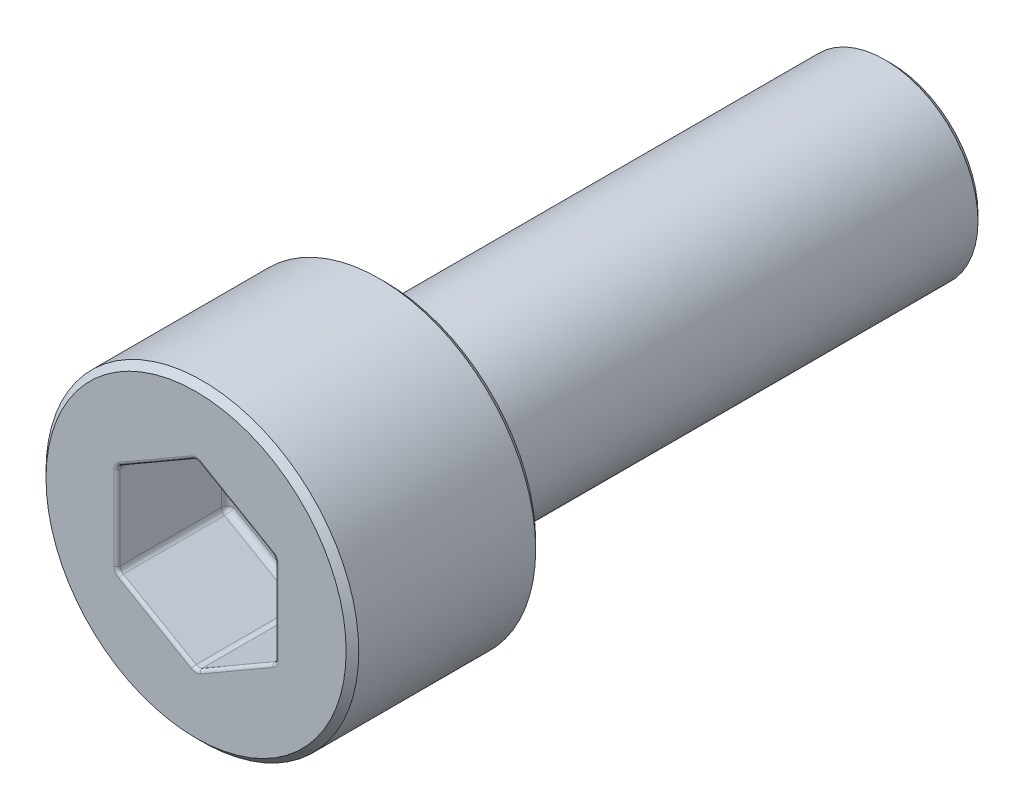
from build123d import *

# Parameters (mm, degrees)
SCHNITT_LINEAR_AUSTRAGEN1_DEPTH = 3.5
FASE1_SIZE                      = 0.2
VERRUNDUNG1_R                   = 0.2
VERRUNDUNG2_R                   = 0.1


with BuildPart() as part:
    # Skizze1 → Rotation1 (revolve)
    with BuildSketch(Plane(origin=(0, 0, 0), x_dir=(0, 0, -1), z_dir=(1, 0, 0))):
        Polygon((-6, 0), (-6, 4.95), (0, 4.95), (0, 2.95), (16, 2.95), (16, 0), align=None)
    revolve(axis=Axis((0, 0, 21.919879518), (0, 0, -1)))

    # Skizze2 → Schnitt-Linear austragen1 (cut)
    with BuildSketch(Plane.XY.offset(6)):
        Polygon((2.5, -1.443375673), (2.5, 1.443375673), (0, 2.886751346), (-2.5, 1.443375673), (-2.5, -1.443375673), (0, -2.886751346), align=None)
    extrude(amount=-SCHNITT_LINEAR_AUSTRAGEN1_DEPTH, mode=Mode.SUBTRACT)

    # Fase1
    fase1_edges = [part.edges().sort_by_distance(p)[0] for p in [
        (0, -4.95, 6),
        (0, -4.95, 0),
        (0, -2.95, -16),
    ]]
    chamfer(fase1_edges, length=FASE1_SIZE)

    # Verrundung1
    verrundung1_edges = [part.edges().sort_by_distance(p)[0] for p in [
        (-1.25, -2.165063509, 2.5),
        (-2.5, 0, 2.5),
        (-1.25, 2.165063509, 2.5),
        (1.25, 2.165063509, 2.5),
        (2.5, 0, 2.5),
        (1.25, -2.165063509, 2.5),
        (-2.5, -1.443375673, 4.25),
        (0, -2.886751346, 4.25),
        (2.5, -1.443375673, 4.25),
        (2.5, 1.443375673, 4.25),
        (0, 2.886751346, 4.25),
        (-2.5, 1.443375673, 4.25),
        (0, -2.95, 0),
    ]]
    fillet(verrundung1_edges, radius=VERRUNDUNG1_R)

    # Verrundung2
    verrundung2_edges = [part.edges().sort_by_distance(p)[0] for p in [
        (2.473205081, -1.427905619, 6),
        (1.25, -2.165063509, 6),
        (0, -2.855811238, 6),
        (-1.25, -2.165063509, 6),
        (-2.473205081, -1.427905619, 6),
        (-2.5, 0, 6),
        (-2.473205081, 1.427905619, 6),
        (-1.25, 2.165063509, 6),
        (0, 2.855811238, 6),
        (1.25, 2.165063509, 6),
        (2.473205081, 1.427905619, 6),
        (2.5, 0, 6),
    ]]
    fillet(verrundung2_edges, radius=VERRUNDUNG2_R)


solid = part.part
